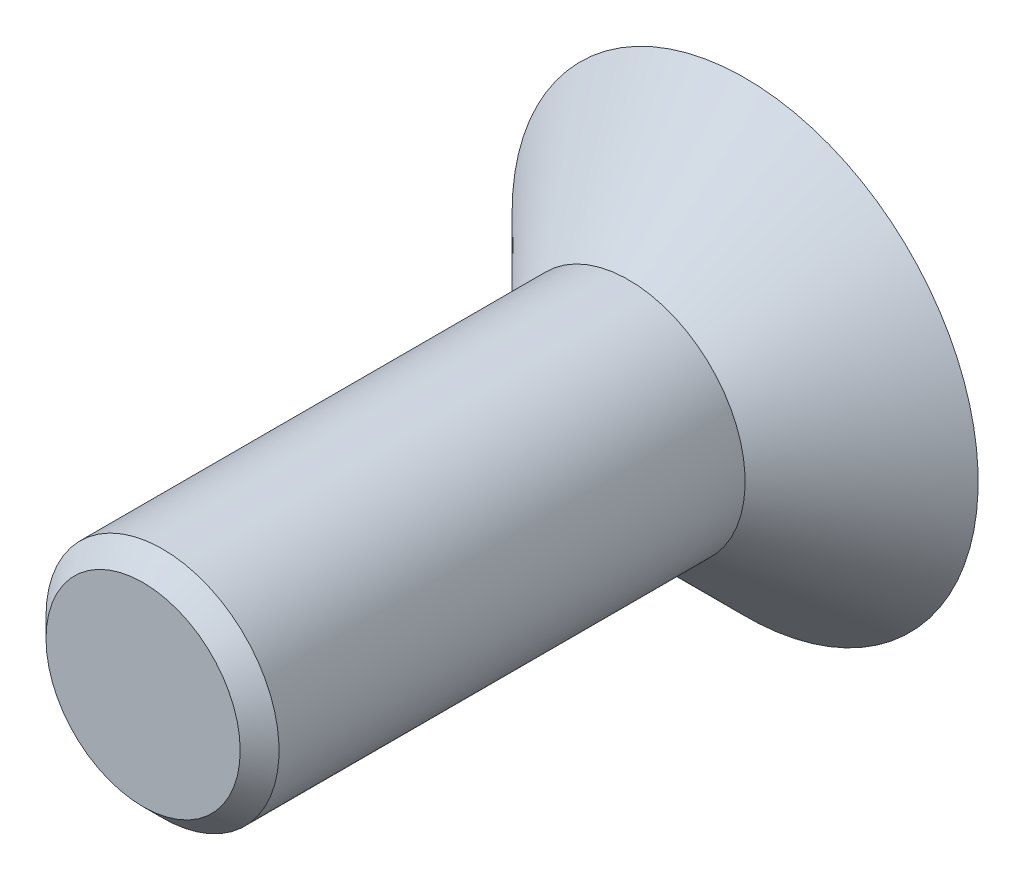
from build123d import *

# Parameters (mm, degrees)
CHAMFER1_SIZE = 1


with BuildPart() as part:
    # Sketch1 → Revolve1 (revolve)
    with BuildSketch(Plane(origin=(0, 0, 0), x_dir=(1, 0, 0), z_dir=(0, 1, 0)), mode=Mode.PRIVATE) as revolve1_sk:
        Polygon((6, 0), (6, 25), (12, 31), (1, 31), (1, 29), (0, 29), (0, 0), align=None)
    revolve(revolve1_sk.sketch.rotate(Axis((0, 0, -48.72611465), (0, 0, 1)), 180), axis=Axis((0, 0, -48.72611465), (0, 0, 1)))

    # Chamfer1
    chamfer1_edges = [part.edges().sort_by_distance(p)[0] for p in [
        (6, 0, 0),
    ]]
    chamfer(chamfer1_edges, length=CHAMFER1_SIZE)


solid = part.part
